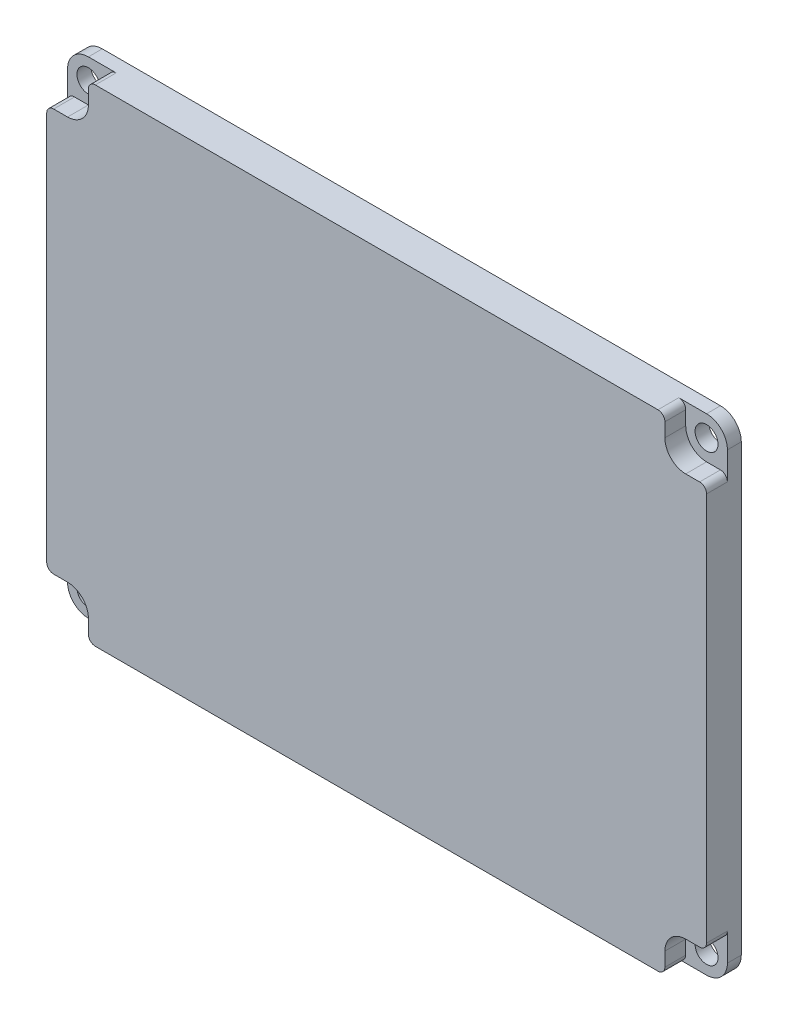
from build123d import *

# Parameters (mm, degrees)
SKETCH_1_W          = 95
SKETCH_1_H          = 70
EXTRUDE_1_DEPTH     = 5
FILLET_1_R          = 3
SKETCH_13_R         = 1.65
CUT_EXTRUDE_2_DEPTH = 5
SKETCH_14_R         = 3
CUT_EXTRUDE_3_DEPTH = 3
CUT_EXTRUDE_4_DEPTH = 3
FILLET_3_R          = 1


with BuildPart() as part:
    # ｽｹｯﾁ1 → ﾎﾞｽ - 押し出し1 (new body)
    with BuildSketch(Plane.XY):
        with Locations((47.5, 35)):
            Rectangle(SKETCH_1_W, SKETCH_1_H)
    extrude(amount=EXTRUDE_1_DEPTH)

    # ﾌｨﾚｯﾄ1
    fillet_1_edges = [part.edges().sort_by_distance(p)[0] for p in [
        (0, 70, 2.5),
        (95, 70, 2.5),
        (95, 0, 2.5),
        (0, 0, 2.5),
    ]]
    fillet(fillet_1_edges, radius=FILLET_1_R)

    # ｽｹｯﾁ13 → ｶｯﾄ - 押し出し2 (cut)
    with BuildSketch(Plane.XY.offset(5)):
        with Locations((3, 67)):
            Circle(SKETCH_13_R)
        with Locations((92, 67)):
            Circle(SKETCH_13_R)
        with Locations((3, 3)):
            Circle(SKETCH_13_R)
        with Locations((92, 3)):
            Circle(SKETCH_13_R)
    extrude(amount=-CUT_EXTRUDE_2_DEPTH, mode=Mode.SUBTRACT)

    # ｽｹｯﾁ14 → ｶｯﾄ - 押し出し3 (cut)
    with BuildSketch(Plane.XY.offset(5)):
        with Locations((3, 67)):
            Circle(SKETCH_14_R)
        with Locations((92, 67)):
            Circle(SKETCH_14_R)
        with Locations((3, 3)):
            Circle(SKETCH_14_R)
        with Locations((92, 3)):
            Circle(SKETCH_14_R)
    extrude(amount=-CUT_EXTRUDE_3_DEPTH, mode=Mode.SUBTRACT)

    # ｽｹｯﾁ15 → ｶｯﾄ - 押し出し4 (cut)
    with BuildSketch(Plane.XY.offset(5)):
        with BuildLine():
            Line((95, 3), (95, 6))
            Line((95, 6), (92, 6))
            ThreePointArc((92, 6), (94.121320344, 5.121320344), (95, 3))
        make_face()
        with BuildLine():
            Line((89, 3), (89, 0))
            Line((89, 0), (92, 0))
            ThreePointArc((92, 0), (89.878679656, 0.878679656), (89, 3))
        make_face()
        with BuildLine():
            Line((6, 0), (6, 3))
            ThreePointArc((6, 3), (5.121320344, 0.878679656), (3, 0))
            Line((3, 0), (6, 0))
        make_face()
        with BuildLine():
            Line((3, 6), (0, 6))
            Line((0, 6), (0, 3))
            ThreePointArc((0, 3), (0.878679656, 5.121320344), (3, 6))
        make_face()
        with BuildLine():
            Line((0, 64), (3, 64))
            ThreePointArc((3, 64), (0.878679656, 64.878679656), (0, 67))
            Line((0, 67), (0, 64))
        make_face()
        with BuildLine():
            ThreePointArc((3, 70), (5.121320344, 69.121320344), (6, 67))
            Line((6, 67), (6, 70))
            Line((6, 70), (3, 70))
        make_face()
        with BuildLine():
            Line((92, 70), (89, 70))
            Line((89, 70), (89, 67))
            ThreePointArc((89, 67), (89.878679656, 69.121320344), (92, 70))
        make_face()
        with BuildLine():
            ThreePointArc((95, 67), (94.121320344, 64.878679656), (92, 64))
            Line((92, 64), (95, 64))
            Line((95, 64), (95, 67))
        make_face()
    extrude(amount=-CUT_EXTRUDE_4_DEPTH, mode=Mode.SUBTRACT)

    # ﾌｨﾚｯﾄ3
    fillet_3_edges = [part.edges().sort_by_distance(p)[0] for p in [
        (0, 64, 3.5),
        (0, 6, 3.5),
        (6, 0, 3.5),
        (89, 0, 3.5),
        (95, 64, 3.5),
        (89, 70, 3.5),
        (6, 70, 3.5),
        (95, 6, 3.5),
    ]]
    fillet(fillet_3_edges, radius=FILLET_3_R)


solid = part.part
